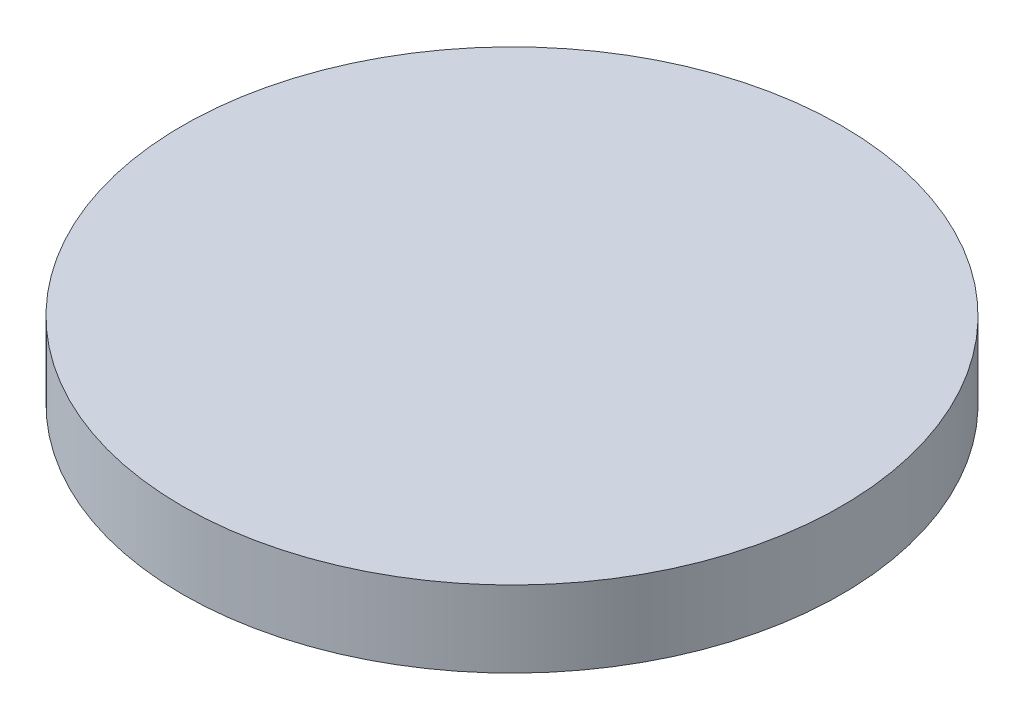
from build123d import *

# Parameters (mm, degrees)
SKETCH_1_R      = 9.5
EXTRUDE_1_DEPTH = 2.2


with BuildPart() as part:
    # Эскиз1 → Бобышка-Вытянуть1 (new body)
    with BuildSketch(Plane(origin=(0, 0, 0), x_dir=(1, 0, 0), z_dir=(0, 1, 0))):
        with Locations(Location((0, 0, 0), (0, 0, 270))):
            Circle(SKETCH_1_R)
    extrude(amount=EXTRUDE_1_DEPTH)


solid = part.part
